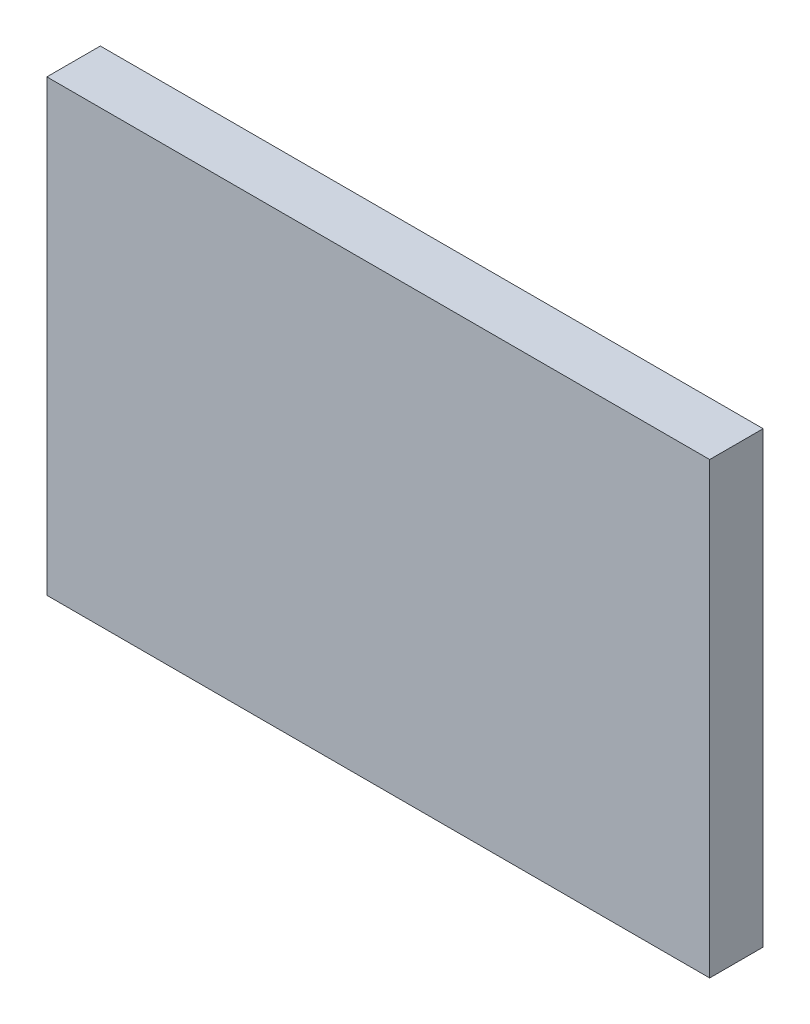
from build123d import *

# Parameters (mm, degrees)
SKETCH1_W           = 62
SKETCH1_H           = 42
BOSS_EXTRUDE1_DEPTH = 5


with BuildPart() as part:
    # Sketch1 → Boss-Extrude1 (new body)
    with BuildSketch(Plane.XY):
        Rectangle(SKETCH1_W, SKETCH1_H)
    extrude(amount=BOSS_EXTRUDE1_DEPTH)


solid = part.part
